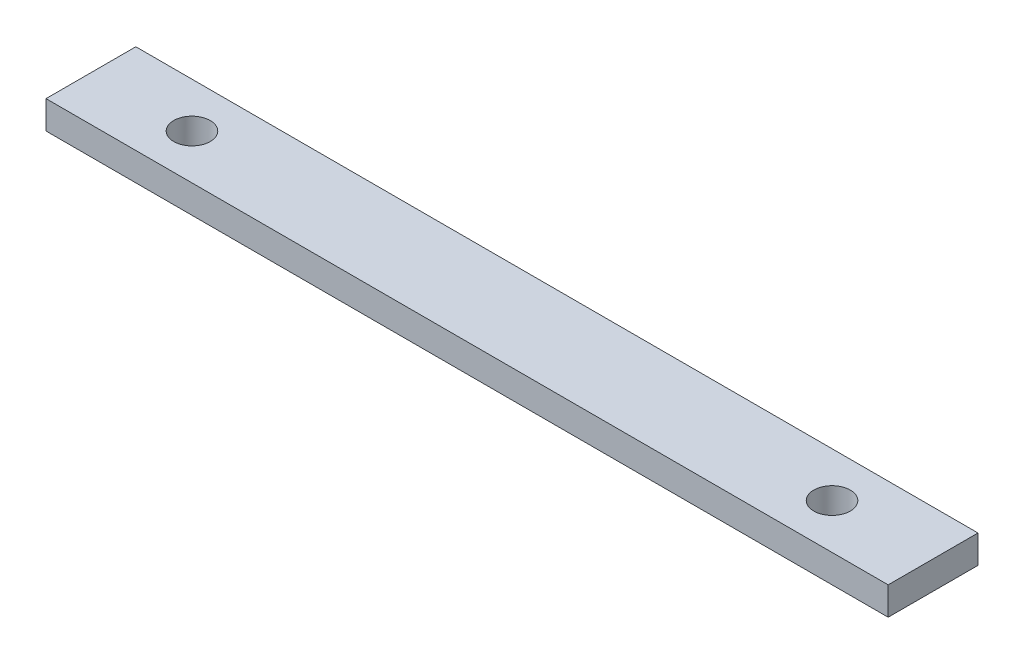
from build123d import *

# Parameters (mm, degrees)
SKETCH1_W           = 150
SKETCH1_H           = 16
BOSS_EXTRUDE1_DEPTH = 5
CUT_EXTRUDE1_REACH  = 77.591
SKETCH2_R           = 3.25


with BuildPart() as part:
    # Sketch1 → Boss-Extrude1 (new body)
    with BuildSketch(Plane(origin=(0, 0, 0), x_dir=(1, 0, 0), z_dir=(0, 1, 0))):
        Rectangle(SKETCH1_W, SKETCH1_H)
    extrude(amount=BOSS_EXTRUDE1_DEPTH)

    # Sketch2 → Cut-Extrude1 (cut, up to next)
    with BuildSketch(Plane(origin=(0, 5, 0), x_dir=(1, 0, 0), z_dir=(0, 1, 0)), mode=Mode.PRIVATE) as cut_extrude1_sk1:
        with Locations(Location((-57, 0, 0), (0, 0, 270))):
            Circle(SKETCH2_R)
    cut_extrude1_tool1 = extrude(cut_extrude1_sk1.sketch, amount=-CUT_EXTRUDE1_REACH, mode=Mode.PRIVATE) & part.part
    # Sketch2 → Cut-Extrude1 (cut, up to next)
    with BuildSketch(Plane(origin=(0, 5, 0), x_dir=(1, 0, 0), z_dir=(0, 1, 0)), mode=Mode.PRIVATE) as cut_extrude1_sk2:
        with Locations(Location((57, 0, 0), (0, 0, 90))):
            Circle(SKETCH2_R)
    cut_extrude1_tool2 = extrude(cut_extrude1_sk2.sketch, amount=-CUT_EXTRUDE1_REACH, mode=Mode.PRIVATE) & part.part
    add(cut_extrude1_tool1.solids().sort_by_distance((-57, 5, 0))[0], mode=Mode.SUBTRACT)
    add(cut_extrude1_tool2.solids().sort_by_distance((57, 5, 0))[0], mode=Mode.SUBTRACT)


solid = part.part
